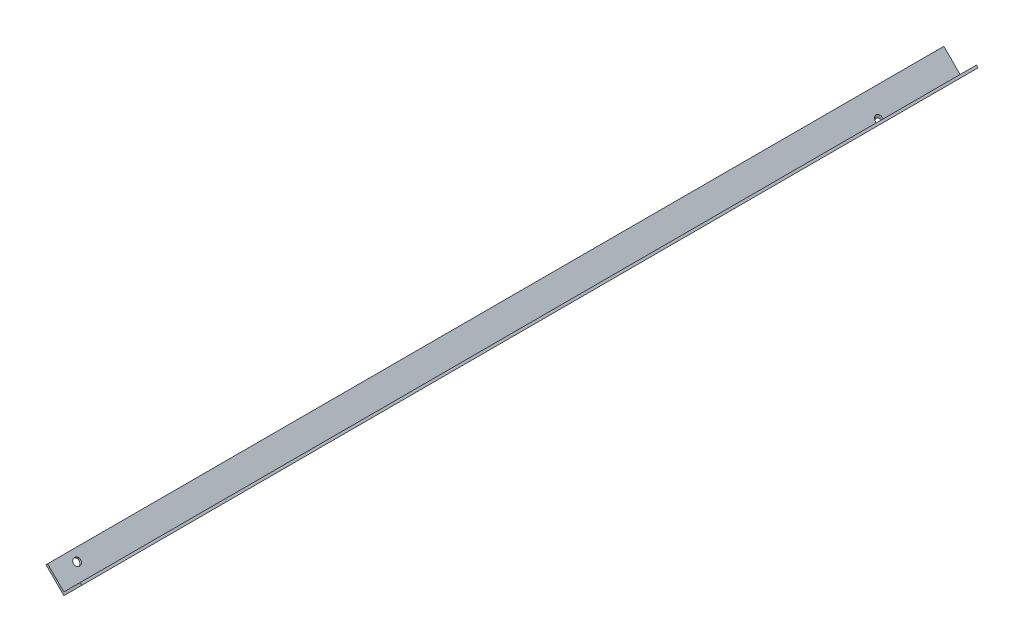
from build123d import *

# Parameters (mm, degrees)
BOSS_EXTRUDE1_DEPTH      = 438.15
BOSS_EXTRUDE1_DEPTH_BACK = 57.15
SKETCH2_R                = 1.984375
CUT_EXTRUDE1_DEPTH       = 439.353336876
SKETCH3_R                = 1.984375
CUT_EXTRUDE2_DEPTH       = 439.353336876
CUT_EXTRUDE3_DEPTH       = 439.353336876
CUT_EXTRUDE3_DEPTH_BACK  = 439.353336876
SKETCH4_R                = 1.984375


with BuildPart() as part:
    # Sketch1 → Boss-Extrude1 (new, two sides: drawn at the far end of the back side and taken through both)
    with BuildSketch(Plane.XY.offset(-BOSS_EXTRUDE1_DEPTH_BACK)):
        Polygon((0, 0), (-8.980256121, 8.980256121), (-9.878281733, 8.082230509), (0, -1.796051224), (9.878281733, 8.082230509), (8.980256121, 8.980256121), align=None)
    extrude(amount=BOSS_EXTRUDE1_DEPTH + BOSS_EXTRUDE1_DEPTH_BACK)

    # Sketch2 → Cut-Extrude1 (cut, through all)
    with BuildSketch(Plane(origin=(0, 0, 0), x_dir=(0, 0, 1), z_dir=(-0.7071067811865469, 0.7071067811865481, 0))):
        with Locations(Location((431.8, 7.62, 0), (0, 0, 270))):
            Circle(SKETCH2_R)
        with Locations(Location((419.1, 7.62, 0), (0, 0, 270))):
            Circle(SKETCH2_R)
    extrude(amount=-CUT_EXTRUDE1_DEPTH, mode=Mode.SUBTRACT)

    # Sketch3 → Cut-Extrude2 (cut, through all)
    with BuildSketch(Plane(origin=(0, 0, 0), x_dir=(0, 0, -1), z_dir=(0.7071067811865483, 0.7071067811865468, 0))):
        with Locations(Location((-425.45, 7.62, 0), (0, 0, 90))):
            Circle(SKETCH3_R)
    extrude(amount=-CUT_EXTRUDE2_DEPTH, mode=Mode.SUBTRACT)

    # Sketch4 → Cut-Extrude3 (cut, two sides: drawn at the far end of the back side and taken through both)
    with BuildSketch(Plane(origin=(0, 0, 0), x_dir=(1, 0, 0), z_dir=(0, 1, 0)).offset(-CUT_EXTRUDE3_DEPTH_BACK)):
        with Locations(Location((0, 12.7, 0), (0, 0, 270))):
            Circle(SKETCH4_R)
    extrude(amount=CUT_EXTRUDE3_DEPTH + CUT_EXTRUDE3_DEPTH_BACK, mode=Mode.SUBTRACT)


solid = part.part
